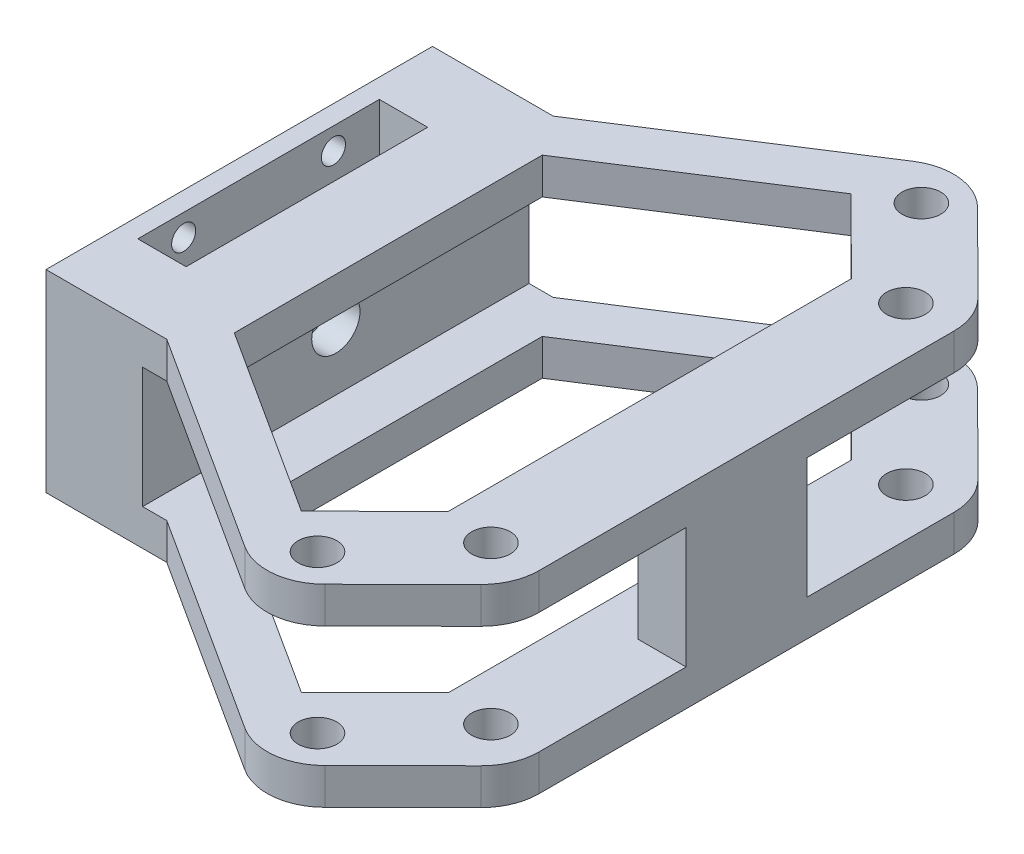
from build123d import *

# Parameters (mm, degrees)
SKETCH1_R           = 4
SKETCH1_W           = 10
SKETCH1_H           = 50
BOSS_EXTRUDE1_DEPTH = 7.5
SKETCH3_W           = 10
SKETCH3_H           = 25
SKETCH3_W_2         = 20
SKETCH3_H_2         = 80
SKETCH3_H_3         = 50
BOSS_EXTRUDE2_DEPTH = 25
LPATTERN1_COUNT     = 2
LPATTERN1_PITCH     = 32.5
SKETCH4_R           = 12.5
CUT_EXTRUDE1_DEPTH  = 3
SKETCH4_3_R         = 5
CUT_EXTRUDE2_DEPTH  = 40
SKETCH4_4_R         = 2.5
CUT_EXTRUDE3_DEPTH  = 4
SKETCH5_R           = 5
CUT_EXTRUDE4_DEPTH  = 5


with BuildPart() as part:
    # Sketch1 → Boss-Extrude1 (new body)
    with BuildSketch(Plane(origin=(0, -20, 0), x_dir=(1, 0, 0), z_dir=(0, 1, 0))):
        with BuildLine():
            Line((0, 40), (0, -40))
            Line((0, -40), (25, -40))
            Line((25, -40), (70.319765879, -69.141388534))
            ThreePointArc((70.319765879, -69.141388534), (78.074234717, -70.981200492), (85.271064581, -67.557410938))
            Line((85.271064581, -67.557410938), (101.461064602, -51.459429229))
            ThreePointArc((101.461064602, -51.459429229), (104.079999441, -47.5579944), (105, -42.95))
            Line((105, -42.95), (105, 42.95))
            ThreePointArc((105, 42.95), (104.079999441, 47.5579944), (101.461064602, 51.459429229))
            Line((101.461064602, 51.459429229), (85.271064581, 67.557410938))
            ThreePointArc((85.271064581, 67.557410938), (78.074234717, 70.981200492), (70.319765879, 69.141388534))
            Line((70.319765879, 69.141388534), (25, 40))
            Line((25, 40), (0, 40))
        make_face()
        with Locations((78.7, -62.5)):
            Circle(SKETCH1_R, mode=Mode.SUBTRACT)
        with Locations((95.05, -42.95)):
            Circle(SKETCH1_R, mode=Mode.SUBTRACT)
        with Locations((95.05, 42.95)):
            Circle(SKETCH1_R, mode=Mode.SUBTRACT)
        with Locations((78.7, 62.5)):
            Circle(SKETCH1_R, mode=Mode.SUBTRACT)
        with Locations((9, 0)):
            Rectangle(SKETCH1_W, SKETCH1_H, mode=Mode.SUBTRACT)
        Polygon((30.85, -31.872701463), (30.85, 31.872701463), (69.747715914, 56.88460147), (85, 41.719006045), (85, -41.719006045), (69.747715914, -56.88460147), align=None, mode=Mode.SUBTRACT)
    boss_extrude1 = extrude(amount=BOSS_EXTRUDE1_DEPTH)

    # Sketch3 → Boss-Extrude2 (add)
    # profile 1 of 2: a face of its own
    with BuildSketch(Plane(origin=(0, -12.5, 0), x_dir=(1, 0, 0), z_dir=(0, 1, 0))):
        with Locations((100, 0)):
            Rectangle(SKETCH3_W, SKETCH3_H)
    # profile 2 of 2: a face of its own
    with BuildSketch(Plane(origin=(0, -12.5, 0), x_dir=(1, 0, 0), z_dir=(0, 1, 0))):
        with Locations((10, 0)):
            Rectangle(SKETCH3_W_2, SKETCH3_H_2)
        with Locations((9, 0)):
            Rectangle(SKETCH3_W, SKETCH3_H_3, mode=Mode.SUBTRACT)
    extrude(amount=BOSS_EXTRUDE2_DEPTH)

    # LPattern1: Boss-Extrude1 ×2
    with Locations(*[(0, i * LPATTERN1_PITCH, 0) for i in range(1, LPATTERN1_COUNT)]):
        add(boss_extrude1)

    # Sketch4 → Cut-Extrude1 (cut)
    with BuildSketch(Plane.ZY):
        Circle(SKETCH4_R)
    extrude(amount=-CUT_EXTRUDE1_DEPTH, mode=Mode.SUBTRACT)

    # Sketch4<3> → Cut-Extrude2 (cut)
    with BuildSketch(Plane.ZY):
        Circle(SKETCH4_3_R)
    extrude(amount=-CUT_EXTRUDE2_DEPTH, mode=Mode.SUBTRACT)

    # Sketch4<4> → Cut-Extrude3 (cut)
    with BuildSketch(Plane.ZY):
        with Locations((15.5, 15.5)):
            Circle(SKETCH4_4_R)
        with Locations((-15.5, 15.5)):
            Circle(SKETCH4_4_R)
        with Locations((-15.5, -15.5)):
            Circle(SKETCH4_4_R)
        with Locations((15.5, -15.5)):
            Circle(SKETCH4_4_R)
    extrude(amount=-CUT_EXTRUDE3_DEPTH, mode=Mode.SUBTRACT)

    # Sketch5 → Cut-Extrude4 (cut)
    with BuildSketch(Plane.ZY.offset(-95)):
        Circle(SKETCH5_R)
    extrude(amount=-CUT_EXTRUDE4_DEPTH, mode=Mode.SUBTRACT)


solid = part.part
